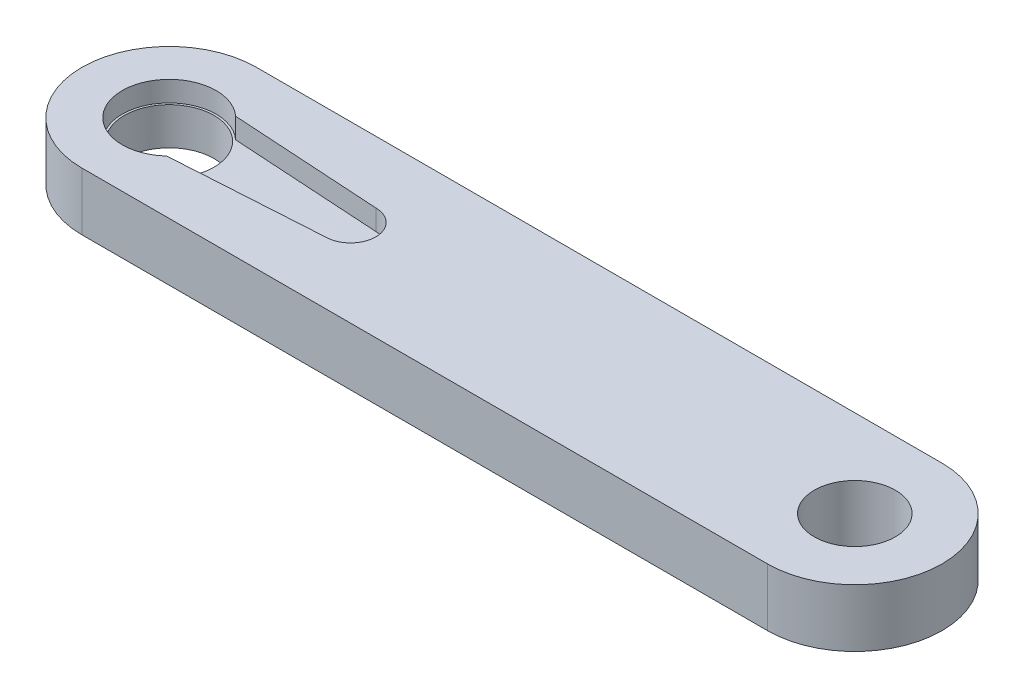
from build123d import *

# Parameters (mm, degrees)
BOSS_EXTRUDE1_DEPTH = 3
SKETCH2_R           = 3.6
CUT_EXTRUDE1_DEPTH  = 3.95
BOSS_EXTRUDE2_DEPTH = 1.64
SKETCH4_R           = 3.25
CUT_EXTRUDE2_DEPTH  = 4.64


with BuildPart() as part:
    # Sketch1 → Boss-Extrude1 (new body)
    with BuildSketch(Plane(origin=(0, 0, 0), x_dir=(1, 0, 0), z_dir=(0, 1, 0))):
        with BuildLine():
            Line((0, 7), (55, 7))
            ThreePointArc((55, 7), (62, 0), (55, -7))
            Line((55, -7), (0, -7))
            ThreePointArc((0, -7), (-7, 0), (0, 7))
        make_face()
    extrude(amount=BOSS_EXTRUDE1_DEPTH)

    # Sketch2 → Cut-Extrude1 (cut)
    with BuildSketch(Plane.XZ):
        with Locations(Location((0, 0, 0), (0, 0, 270))):
            Circle(SKETCH2_R)
    extrude(amount=-CUT_EXTRUDE1_DEPTH, mode=Mode.SUBTRACT)

    # Sketch3 → Boss-Extrude2 (add)
    with BuildSketch(Plane(origin=(0, 3, 0), x_dir=(1, 0, 0), z_dir=(0, 1, 0))):
        with BuildLine():
            Line((0, -7), (55, -7))
            ThreePointArc((55, -7), (62, 0), (55, 7))
            Line((55, 7), (0, 7))
            ThreePointArc((0, 7), (-7, 0), (0, -7))
        make_face()
        with BuildLine():
            Line((14.555396889, 2.01999279), (2.561818442, 2.765860855))
            ThreePointArc((2.561818442, 2.765860855), (-3.77, 0), (2.561818442, -2.765860855))
            Line((2.561818442, -2.765860855), (14.555396889, -2.01999279))
            ThreePointArc((14.555396889, -2.01999279), (16.57, 0), (14.555396889, 2.01999279))
        make_face(mode=Mode.SUBTRACT)
    extrude(amount=BOSS_EXTRUDE2_DEPTH)

    # Sketch4 → Cut-Extrude2 (cut)
    with BuildSketch(Plane(origin=(0, 4.64, 0), x_dir=(1, 0, 0), z_dir=(0, 1, 0))):
        with Locations(Location((55, 0, 0), (0, 0, 270))):
            Circle(SKETCH4_R)
    extrude(amount=-CUT_EXTRUDE2_DEPTH, mode=Mode.SUBTRACT)


solid = part.part
